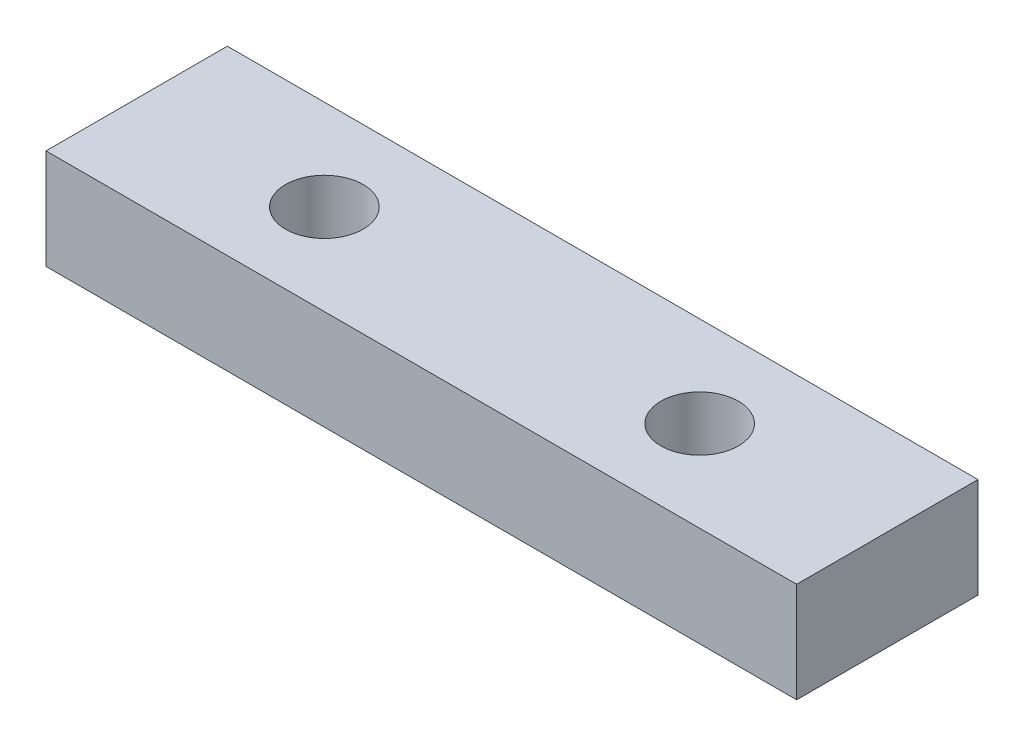
from build123d import *

# Parameters (mm, degrees)
SKETCH1_W           = 30
SKETCH1_H           = 7.247877258
SKETCH1_R           = 1.55
BOSS_EXTRUDE1_DEPTH = 4


with BuildPart() as part:
    # Sketch1 → Boss-Extrude1 (new body)
    with BuildSketch(Plane(origin=(0, 0, 0), x_dir=(1, 0, 0), z_dir=(0, 1, 0))):
        with Locations((0, -3.623938629)):
            Rectangle(SKETCH1_W, SKETCH1_H)
        with Locations(Location((7.5, -3.623938629, 0), (0, 0, 270))):
            Circle(SKETCH1_R, mode=Mode.SUBTRACT)
        with Locations(Location((-7.5, -3.623938629, 0), (0, 0, 270))):
            Circle(SKETCH1_R, mode=Mode.SUBTRACT)
    extrude(amount=BOSS_EXTRUDE1_DEPTH)


solid = part.part
